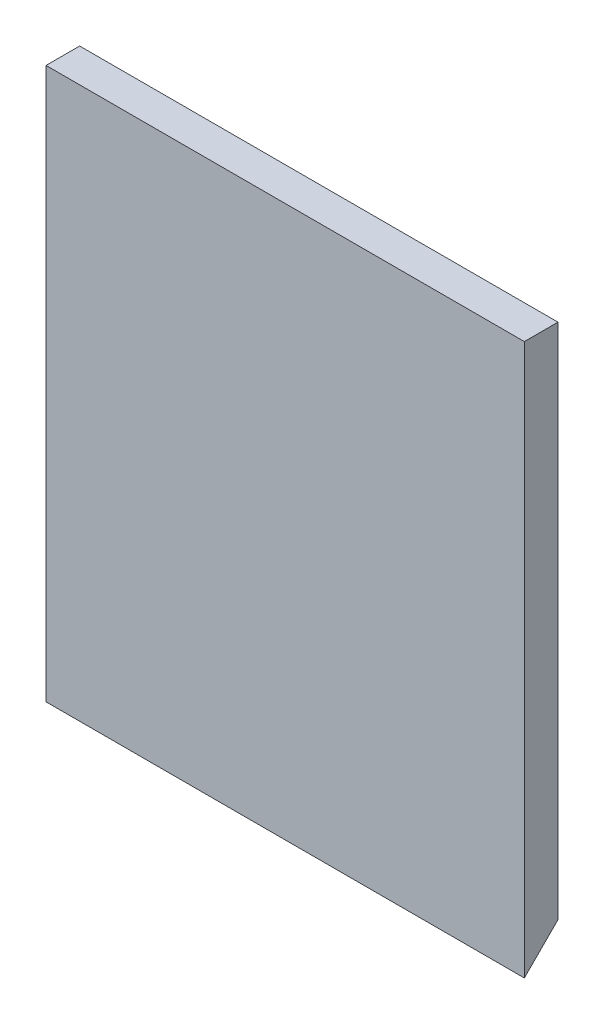
from build123d import *

# Parameters (mm, degrees)
ESQUISSE1_W                  = 256
ESQUISSE1_H                  = 295
BOSS_EXTRU_1_DEPTH           = 18
ENL_V_MAT_EXTRU_1_DEPTH      = 392.005115056
ENL_V_MAT_EXTRU_1_DEPTH_BACK = 392.005115056


with BuildPart() as part:
    # Esquisse1 → Boss.-Extru.1 (new body)
    with BuildSketch(Plane.XY):
        with Locations((0, 147.5)):
            Rectangle(ESQUISSE1_W, ESQUISSE1_H)
    extrude(amount=BOSS_EXTRU_1_DEPTH)

    # Esquisse2 → Enlèv. mat.-Extru.1 (cut, two sides: drawn at the far end of the back side and taken through both)
    with BuildSketch(Plane(origin=(128, 0, 0), x_dir=(0, 0, -1), z_dir=(1, 0, 0)).offset(-ENL_V_MAT_EXTRU_1_DEPTH_BACK)):
        Polygon((-18, 0), (0, 18), (0, 0), align=None)
    extrude(amount=ENL_V_MAT_EXTRU_1_DEPTH + ENL_V_MAT_EXTRU_1_DEPTH_BACK, mode=Mode.SUBTRACT)


solid = part.part
